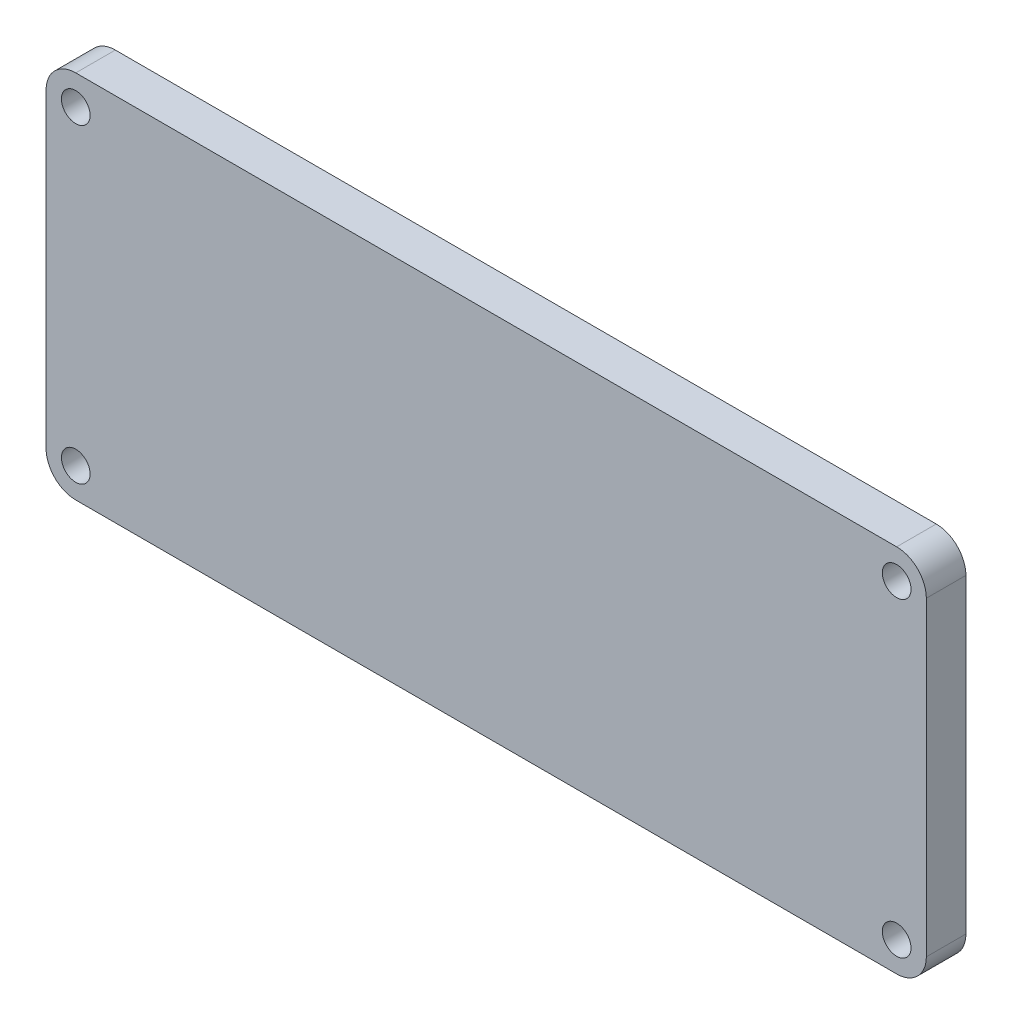
from build123d import *
from OCP.BRepFilletAPI import BRepFilletAPI_MakeChamfer

# Parameters (mm, degrees)
SKETCH_1_W          = 89
SKETCH_1_H          = 37.4
EXTRUDE_1_DEPTH     = 4
FILLET_1_R          = 3
SKETCH_2_R          = 1.45
CUT_EXTRUDE_3_DEPTH = 4
CHAMFER_1_SIZE      = 1.2
CHAMFER_1_SIZE2     = 1.5


with BuildPart() as part:
    # 스케치1 → 보스-돌출1 (new body)
    with BuildSketch(Plane.XY):
        Rectangle(SKETCH_1_W, SKETCH_1_H)
    extrude(amount=EXTRUDE_1_DEPTH)

    # 필렛1
    fillet_1_edges = [part.edges().sort_by_distance(p)[0] for p in [
        (-44.5, -18.7, 2),
        (44.5, -18.7, 2),
        (44.5, 18.7, 2),
        (-44.5, 18.7, 2),
    ]]
    fillet(fillet_1_edges, radius=FILLET_1_R)

    # 스케치2 → 컷-돌출3 (cut)
    with BuildSketch(Plane.XY):
        with Locations((-41.5, 15.7)):
            Circle(SKETCH_2_R)
        with Locations(Location((41.5, 15.7, 0), (0, 0, 180))):
            Circle(SKETCH_2_R)
        with Locations((41.5, -15.7)):
            Circle(SKETCH_2_R)
        with Locations(Location((-41.5, -15.7, 0), (0, 0, 180))):
            Circle(SKETCH_2_R)
    extrude(amount=CUT_EXTRUDE_3_DEPTH, mode=Mode.SUBTRACT)

    # 모따기1: one chamfer whose edges measure the first distance from different faces: ONE call of the kernel's chamfer builder (chamfer() names one face for all edges)
    chamfer_1_edges_1 = [part.edges().sort_by_distance(p)[0] for p in [
        (-40.05, -15.7, 0),
    ]]
    chamfer_1_side_1 = [part.faces().sort_by_distance(p)[0] for p in [
        (-40.05, -15.7, 2),
    ]]
    chamfer_1_edges_2 = [part.edges().sort_by_distance(p)[0] for p in [
        (40.05, -15.7, 0),
    ]]
    chamfer_1_side_2 = [part.faces().sort_by_distance(p)[0] for p in [
        (40.05, -15.7, 2),
    ]]
    chamfer_1_edges_3 = [part.edges().sort_by_distance(p)[0] for p in [
        (42.95, 15.7, 0),
    ]]
    chamfer_1_side_3 = [part.faces().sort_by_distance(p)[0] for p in [
        (42.95, 15.7, 2),
    ]]
    chamfer_1_edges_4 = [part.edges().sort_by_distance(p)[0] for p in [
        (-42.95, 15.7, 0),
    ]]
    chamfer_1_side_4 = [part.faces().sort_by_distance(p)[0] for p in [
        (-42.95, 15.7, 2),
    ]]
    chamfer_1 = BRepFilletAPI_MakeChamfer(part.part.solid().wrapped)
    for e in chamfer_1_edges_1:
        chamfer_1.Add(CHAMFER_1_SIZE, CHAMFER_1_SIZE2, e.wrapped, chamfer_1_side_1[0].wrapped)  # the first distance lies on this face
    for e in chamfer_1_edges_2:
        chamfer_1.Add(CHAMFER_1_SIZE, CHAMFER_1_SIZE2, e.wrapped, chamfer_1_side_2[0].wrapped)  # the first distance lies on this face
    for e in chamfer_1_edges_3:
        chamfer_1.Add(CHAMFER_1_SIZE, CHAMFER_1_SIZE2, e.wrapped, chamfer_1_side_3[0].wrapped)  # the first distance lies on this face
    for e in chamfer_1_edges_4:
        chamfer_1.Add(CHAMFER_1_SIZE, CHAMFER_1_SIZE2, e.wrapped, chamfer_1_side_4[0].wrapped)  # the first distance lies on this face
    add(Compound.cast(chamfer_1.Shape()), mode=Mode.REPLACE)


solid = part.part
